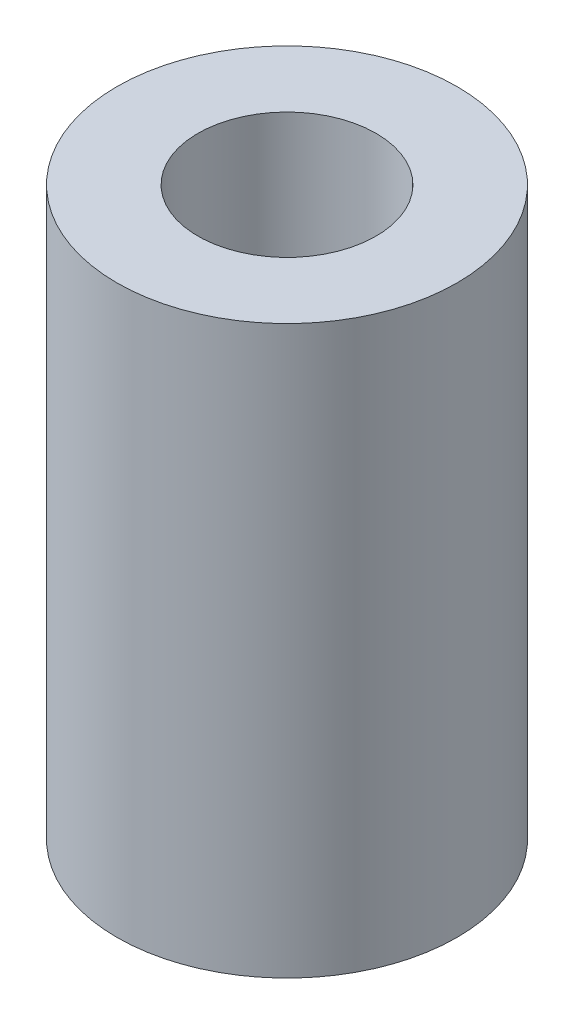
from build123d import *

# Parameters (mm, degrees)
SKETCH_1_R      = 3.15
SKETCH_1_R_2    = 1.65
EXTRUDE_1_DEPTH = 10.5


with BuildPart() as part:
    # 草图1 → 凸台-拉伸1 (new body)
    with BuildSketch(Plane(origin=(0, 0, 0), x_dir=(1, 0, 0), z_dir=(0, 1, 0))):
        with Locations(Location((0, 0, 0), (0, 0, 90))):
            Circle(SKETCH_1_R)
        with Locations(Location((0, 0, 0), (0, 0, 90))):
            Circle(SKETCH_1_R_2, mode=Mode.SUBTRACT)
    extrude(amount=EXTRUDE_1_DEPTH)


solid = part.part
